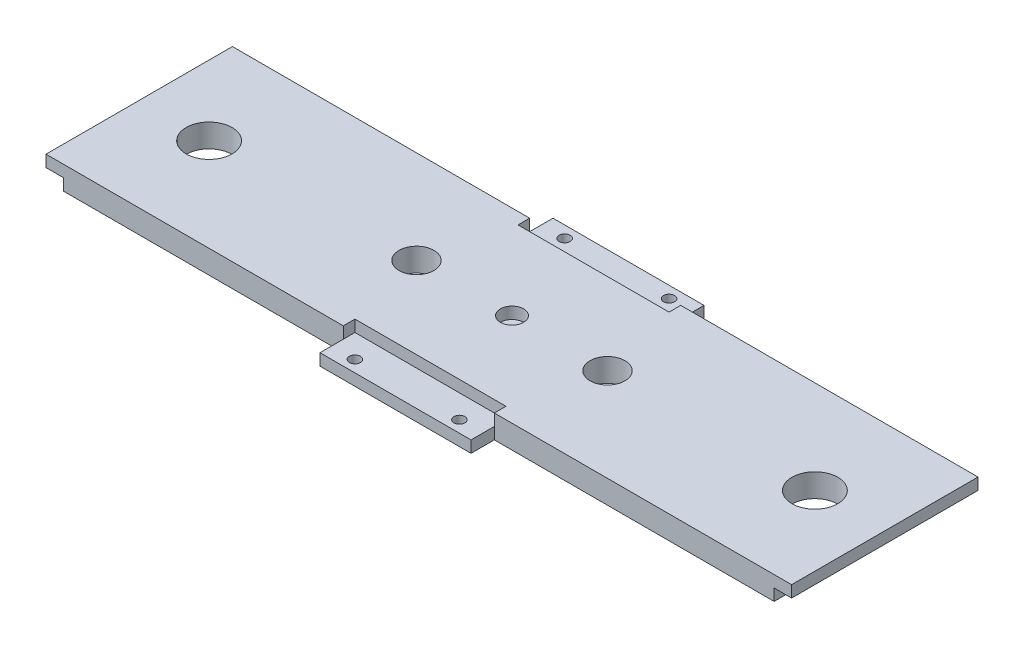
from build123d import *

# Parameters (mm, degrees)
SKETCH1_W                = 203.2
SKETCH1_H                = 50.8
SKETCH1_R                = 6.25
SKETCH1_R_2              = 3.175
BOSS_EXTRUDE1_DEPTH      = 6.35
SKETCH2_W                = 41.159999976
SKETCH2_H                = 3.175
CUT_EXTRUDE1_DEPTH       = 3.175
SKETCH3_W                = 4.7625
SKETCH3_H                = 50.8
CUT_EXTRUDE2_DEPTH       = 3.175
SKETCH4_R                = 4.7625
CUT_EXTRUDE3_DEPTH       = 105.919218926
BOSS_EXTRUDE2_DEPTH      = 6.35
BOSS_EXTRUDE2_DEPTH_BACK = 57.15
SKETCH5_W                = 41.159999976
SKETCH5_H                = 3.175
SKETCH6_R                = 1.5
CUT_EXTRUDE4_DEPTH       = 6.35


with BuildPart() as part:
    # Sketch1 → Boss-Extrude1 (new body)
    with BuildSketch(Plane(origin=(0, 0, 0), x_dir=(1, 0, 0), z_dir=(0, 1, 0))):
        Rectangle(SKETCH1_W, SKETCH1_H)
        with Locations(Location((-82.55, 0, 0), (0, 0, 270))):
            Circle(SKETCH1_R, mode=Mode.SUBTRACT)
        with Locations(Location((82.55, 0, 0), (0, 0, 90))):
            Circle(SKETCH1_R, mode=Mode.SUBTRACT)
        with Locations(Location((0, 0, 0), (0, 0, 270))):
            Circle(SKETCH1_R_2, mode=Mode.SUBTRACT)
    extrude(amount=BOSS_EXTRUDE1_DEPTH)

    # Sketch2 → Cut-Extrude1 (cut)
    with BuildSketch(Plane(origin=(0, 6.35, 0), x_dir=(1, 0, 0), z_dir=(0, 1, 0))):
        with Locations((0, -23.8125)):
            Rectangle(SKETCH2_W, SKETCH2_H)
        with Locations((0, 23.8125)):
            Rectangle(SKETCH2_W, SKETCH2_H)
    extrude(amount=-CUT_EXTRUDE1_DEPTH, mode=Mode.SUBTRACT)

    # Sketch3 → Cut-Extrude2 (cut)
    with BuildSketch(Plane.XZ):
        with Locations((-99.21875, 0)):
            Rectangle(SKETCH3_W, SKETCH3_H)
        with Locations((99.21875, 0)):
            Rectangle(SKETCH3_W, SKETCH3_H)
    extrude(amount=-CUT_EXTRUDE2_DEPTH, mode=Mode.SUBTRACT)

    # Sketch4 → Cut-Extrude3 (cut, through all)
    with BuildSketch(Plane(origin=(0, 6.35, 0), x_dir=(1, 0, 0), z_dir=(0, 1, 0))):
        with Locations(Location((-26.035, 0, 0), (0, 0, 270))):
            Circle(SKETCH4_R)
        with Locations(Location((26.035, 0, 0), (0, 0, 90))):
            Circle(SKETCH4_R)
    extrude(amount=-CUT_EXTRUDE3_DEPTH, mode=Mode.SUBTRACT)

    # Sketch5 → Boss-Extrude2 (add, two sides: drawn at the far end of the back side and taken through both)
    with BuildSketch(Plane(origin=(0, 0, -25.4), x_dir=(-1, 0, 0), z_dir=(0, 0, -1)).offset(-BOSS_EXTRUDE2_DEPTH_BACK)):
        with Locations((0, 1.5875)):
            Rectangle(SKETCH5_W, SKETCH5_H)
    extrude(amount=BOSS_EXTRUDE2_DEPTH + BOSS_EXTRUDE2_DEPTH_BACK)

    # Sketch6 → Cut-Extrude4 (cut)
    with BuildSketch(Plane(origin=(0, 3.175, 0), x_dir=(1, 0, 0), z_dir=(0, 1, 0))):
        with Locations(Location((-14.229999988, 28.575, 0), (0, 0, 270))):
            Circle(SKETCH6_R)
        with Locations(Location((14.229999988, 28.575, 0), (0, 0, 90))):
            Circle(SKETCH6_R)
        with Locations(Location((14.229999988, -28.575, 0), (0, 0, 270))):
            Circle(SKETCH6_R)
        with Locations(Location((-14.229999988, -28.575, 0), (0, 0, 90))):
            Circle(SKETCH6_R)
    extrude(amount=-CUT_EXTRUDE4_DEPTH, mode=Mode.SUBTRACT)


solid = part.part
